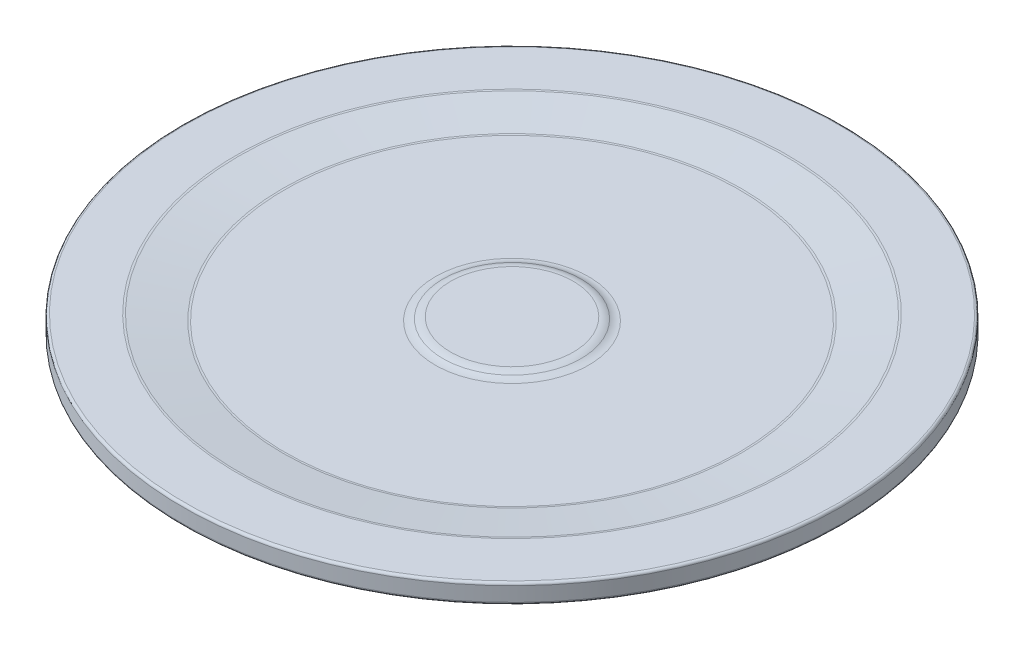
from build123d import *
from OCP.BRepFilletAPI import BRepFilletAPI_MakeFillet

# Parameters (mm, degrees)
FILLET16_R1 = 1.524
FILLET16_R2 = 0.254


with BuildPart() as part:
    # Sketch7041 → Revolve5 (revolve)
    with BuildSketch(Plane.XY):
        with BuildLine():
            Line((0, 81.50225), (6.35, 81.50225))
            ThreePointArc((6.35, 81.50225), (6.758144984, 81.453958267), (7.14375, 81.31175))
            ThreePointArc((7.14375, 81.31175), (7.529355016, 81.169541733), (7.9375, 81.12125))
            Line((7.9375, 81.12125), (23.6225, 81.12125))
            Line((23.6225, 81.12125), (28.385, 81.75625))
            Line((28.385, 81.75625), (34.1, 81.75625))
            Line((34.1, 81.75625), (34.1, 79.75625))
            Line((34.1, 79.75625), (33.703125, 79.75625))
            Line((33.703125, 79.75625), (33.703125, 81.359375))
            Line((33.703125, 81.359375), (28.411341775, 81.359375))
            Line((28.411341775, 81.359375), (23.648841775, 80.724375))
            Line((23.648841775, 80.724375), (7.9375, 80.724375))
            ThreePointArc((7.9375, 80.724375), (7.436735125, 80.783625522), (6.963625189, 80.958104955))
            ThreePointArc((6.963625189, 80.958104955), (6.665525094, 81.068042057), (6.35, 81.105375))
            Line((6.35, 81.105375), (0, 81.105375))
            Line((0, 81.105375), (0, 81.50225))
        make_face()
    revolve(axis=Axis((0, 82.55, 0), (0, -1, 0)))

    # Fillet16: one fillet with a radius per group of edges: ONE call of the kernel's fillet builder (fillet() takes one radius for all edges)
    fillet16_edges_1 = [part.edges().sort_by_distance(p)[0] for p in [
        (-23.6225, 81.12125, 0),
        (-28.385, 81.75625, 0),
        (-23.648841775, 80.724375, 0),
        (-28.411341775, 81.359375, 0),
    ]]
    fillet16_edges_2 = [part.edges().sort_by_distance(p)[0] for p in [
        (-34.1, 81.75625, 0),
        (-33.703125, 81.359375, 0),
        (-34.1, 79.75625, 0),
    ]]
    fillet16 = BRepFilletAPI_MakeFillet(part.part.solid().wrapped)
    for e in fillet16_edges_1:
        fillet16.Add(FILLET16_R1, e.wrapped)
    for e in fillet16_edges_2:
        fillet16.Add(FILLET16_R2, e.wrapped)
    add(Compound.cast(fillet16.Shape()), mode=Mode.REPLACE)


with BuildPart() as body_2:
    # Sketch7042 → Revolve6 (revolve)
    with BuildSketch(Plane.XY):
        with BuildLine():
            Line((27.935091775, 81.295875), (33.449125, 81.295875))
            ThreePointArc((33.449125, 81.295875), (33.527819825, 81.268555111), (33.572657423, 81.198349403))
            ThreePointArc((33.572657423, 81.198349403), (33.670396019, 80.647686296), (33.703125, 80.089375))
            Line((33.703125, 80.089375), (33.703125, 81.359375))
            Line((33.703125, 81.359375), (28.411341775, 81.359375))
            Line((28.411341775, 81.359375), (27.935091775, 81.295875))
        make_face()
    revolve(axis=Axis((0, 82.55, 0), (0, -1, 0)))


solid = Compound([part.part, body_2.part])
